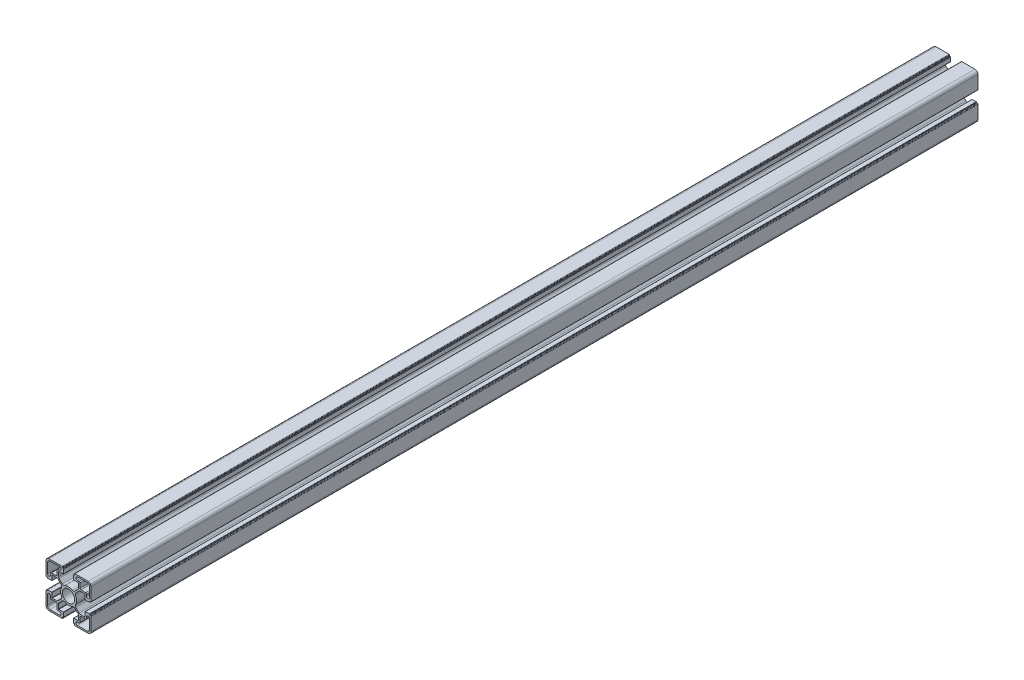
from build123d import *

# Parameters (mm, degrees)
BOSS_EXTRUDE4_DEPTH = 885.824088964
SCALE1_SCALE        = 0.5644444


with BuildPart() as part:
    # Sketch1 → Boss-Extrude4 (new body)
    with BuildSketch(Plane.XY):
        with BuildLine():
            Line((-22.5, 19.5), (-22.5, 6.3))
            ThreePointArc((-22.5, 6.3), (-22.353553391, 5.946446609), (-22, 5.8))
            Line((-22, 5.8), (-21.3, 5.8))
            ThreePointArc((-21.3, 5.8), (-21.087867966, 5.712132034), (-21, 5.5))
            Line((-21, 5.5), (-21, 5.3))
            ThreePointArc((-21, 5.3), (-20.912132034, 5.087867966), (-20.7, 5))
            Line((-20.7, 5), (-16.7, 5))
            ThreePointArc((-16.7, 5), (-16.558578644, 5.058578644), (-16.5, 5.2))
            Line((-16.5, 5.2), (-16.5, 9.8))
            ThreePointArc((-16.5, 9.8), (-16.441421356, 9.941421356), (-16.3, 10))
            Line((-16.3, 10), (-11.864234483, 10))
            ThreePointArc((-11.864234483, 10), (-11.121828624, 9.852326293), (-10.492447327, 9.431787156))
            Line((-10.492447327, 9.431787156), (-7.296699127, 6.236038955))
            ThreePointArc((-7.296699127, 6.236038955), (-6.746669172, 5.129240469), (-6.976648919, 3.914890784))
            ThreePointArc((-6.976648919, 3.914890784), (-7.739935121, 2.023216331), (-8, 0))
            ThreePointArc((-8, 0), (-7.739935121, -2.023216331), (-6.976648919, -3.914890784))
            ThreePointArc((-6.976648919, -3.914890784), (-6.746669172, -5.129240469), (-7.296699127, -6.236038955))
            Line((-7.296699127, -6.236038955), (-10.492447327, -9.431787156))
            ThreePointArc((-10.492447327, -9.431787156), (-11.121828624, -9.852326293), (-11.864234483, -10))
            Line((-11.864234483, -10), (-16.3, -10))
            ThreePointArc((-16.3, -10), (-16.441421356, -9.941421356), (-16.5, -9.8))
            Line((-16.5, -9.8), (-16.5, -5.2))
            ThreePointArc((-16.5, -5.2), (-16.558578644, -5.058578644), (-16.7, -5))
            Line((-16.7, -5), (-20.7, -5))
            ThreePointArc((-20.7, -5), (-20.912132034, -5.087867966), (-21, -5.3))
            Line((-21, -5.3), (-21, -5.5))
            ThreePointArc((-21, -5.5), (-21.087867966, -5.712132034), (-21.3, -5.8))
            Line((-21.3, -5.8), (-22, -5.8))
            ThreePointArc((-22, -5.8), (-22.353553391, -5.946446609), (-22.5, -6.3))
            Line((-22.5, -6.3), (-22.5, -19.5))
            ThreePointArc((-22.5, -19.5), (-21.621320344, -21.621320344), (-19.5, -22.5))
            Line((-19.5, -22.5), (-6.3, -22.5))
            ThreePointArc((-6.3, -22.5), (-5.946446609, -22.353553391), (-5.8, -22))
            Line((-5.8, -22), (-5.8, -21.3))
            ThreePointArc((-5.8, -21.3), (-5.712132034, -21.087867966), (-5.5, -21))
            Line((-5.5, -21), (-5.3, -21))
            ThreePointArc((-5.3, -21), (-5.087867966, -20.912132034), (-5, -20.7))
            Line((-5, -20.7), (-5, -16.7))
            ThreePointArc((-5, -16.7), (-5.058578644, -16.558578644), (-5.2, -16.5))
            Line((-5.2, -16.5), (-9.8, -16.5))
            ThreePointArc((-9.8, -16.5), (-9.941421356, -16.441421356), (-10, -16.3))
            Line((-10, -16.3), (-10, -11.864234483))
            ThreePointArc((-10, -11.864234483), (-9.852326293, -11.121828624), (-9.431787156, -10.492447327))
            Line((-9.431787156, -10.492447327), (-6.236038955, -7.296699127))
            ThreePointArc((-6.236038955, -7.296699127), (-5.129240469, -6.746669172), (-3.914890784, -6.976648919))
            ThreePointArc((-3.914890784, -6.976648919), (-2.023216331, -7.739935121), (0, -8))
            ThreePointArc((0, -8), (2.023216331, -7.739935121), (3.914890784, -6.976648919))
            ThreePointArc((3.914890784, -6.976648919), (5.129240469, -6.746669172), (6.236038955, -7.296699127))
            Line((6.236038955, -7.296699127), (9.431787156, -10.492447327))
            ThreePointArc((9.431787156, -10.492447327), (9.852326293, -11.121828624), (10, -11.864234483))
            Line((10, -11.864234483), (10, -16.3))
            ThreePointArc((10, -16.3), (9.941421356, -16.441421356), (9.8, -16.5))
            Line((9.8, -16.5), (5.2, -16.5))
            ThreePointArc((5.2, -16.5), (5.058578644, -16.558578644), (5, -16.7))
            Line((5, -16.7), (5, -20.7))
            ThreePointArc((5, -20.7), (5.087867966, -20.912132034), (5.3, -21))
            Line((5.3, -21), (5.5, -21))
            ThreePointArc((5.5, -21), (5.712132034, -21.087867966), (5.8, -21.3))
            Line((5.8, -21.3), (5.8, -22))
            ThreePointArc((5.8, -22), (5.946446609, -22.353553391), (6.3, -22.5))
            Line((6.3, -22.5), (19.5, -22.5))
            ThreePointArc((19.5, -22.5), (21.621320344, -21.621320344), (22.5, -19.5))
            Line((22.5, -19.5), (22.5, -6.3))
            ThreePointArc((22.5, -6.3), (22.353553391, -5.946446609), (22, -5.8))
            Line((22, -5.8), (21.3, -5.8))
            ThreePointArc((21.3, -5.8), (21.087867966, -5.712132034), (21, -5.5))
            Line((21, -5.5), (21, -5.3))
            ThreePointArc((21, -5.3), (20.912132034, -5.087867966), (20.7, -5))
            Line((20.7, -5), (16.7, -5))
            ThreePointArc((16.7, -5), (16.558578644, -5.058578644), (16.5, -5.2))
            Line((16.5, -5.2), (16.5, -9.8))
            ThreePointArc((16.5, -9.8), (16.441421356, -9.941421356), (16.3, -10))
            Line((16.3, -10), (11.864234483, -10))
            ThreePointArc((11.864234483, -10), (11.121828624, -9.852326293), (10.492447327, -9.431787156))
            Line((10.492447327, -9.431787156), (7.296699127, -6.236038955))
            ThreePointArc((7.296699127, -6.236038955), (6.746669172, -5.129240469), (6.976648919, -3.914890784))
            ThreePointArc((6.976648919, -3.914890784), (7.739935121, -2.023216331), (8, 0))
            ThreePointArc((8, 0), (7.739935121, 2.023216331), (6.976648919, 3.914890784))
            ThreePointArc((6.976648919, 3.914890784), (6.746669172, 5.129240469), (7.296699127, 6.236038955))
            Line((7.296699127, 6.236038955), (10.492447327, 9.431787156))
            ThreePointArc((10.492447327, 9.431787156), (11.121828624, 9.852326293), (11.864234483, 10))
            Line((11.864234483, 10), (16.3, 10))
            ThreePointArc((16.3, 10), (16.441421356, 9.941421356), (16.5, 9.8))
            Line((16.5, 9.8), (16.5, 5.2))
            ThreePointArc((16.5, 5.2), (16.558578644, 5.058578644), (16.7, 5))
            Line((16.7, 5), (20.7, 5))
            ThreePointArc((20.7, 5), (20.912132034, 5.087867966), (21, 5.3))
            Line((21, 5.3), (21, 5.5))
            ThreePointArc((21, 5.5), (21.087867966, 5.712132034), (21.3, 5.8))
            Line((21.3, 5.8), (22, 5.8))
            ThreePointArc((22, 5.8), (22.353553391, 5.946446609), (22.5, 6.3))
            Line((22.5, 6.3), (22.5, 19.5))
            ThreePointArc((22.5, 19.5), (21.621320344, 21.621320344), (19.5, 22.5))
            Line((19.5, 22.5), (6.3, 22.5))
            ThreePointArc((6.3, 22.5), (5.946446609, 22.353553391), (5.8, 22))
            Line((5.8, 22), (5.8, 21.3))
            ThreePointArc((5.8, 21.3), (5.712132034, 21.087867966), (5.5, 21))
            Line((5.5, 21), (5.3, 21))
            ThreePointArc((5.3, 21), (5.087867966, 20.912132034), (5, 20.7))
            Line((5, 20.7), (5, 16.7))
            ThreePointArc((5, 16.7), (5.058578644, 16.558578644), (5.2, 16.5))
            Line((5.2, 16.5), (9.8, 16.5))
            ThreePointArc((9.8, 16.5), (9.941421356, 16.441421356), (10, 16.3))
            Line((10, 16.3), (10, 11.864234483))
            ThreePointArc((10, 11.864234483), (9.852326293, 11.121828624), (9.431787156, 10.492447327))
            Line((9.431787156, 10.492447327), (6.236038955, 7.296699127))
            ThreePointArc((6.236038955, 7.296699127), (5.129240469, 6.746669172), (3.914890784, 6.976648919))
            ThreePointArc((3.914890784, 6.976648919), (2.023216331, 7.739935121), (0, 8))
            ThreePointArc((0, 8), (-2.023216331, 7.739935121), (-3.914890784, 6.976648919))
            ThreePointArc((-3.914890784, 6.976648919), (-5.129240469, 6.746669172), (-6.236038955, 7.296699127))
            Line((-6.236038955, 7.296699127), (-9.431787156, 10.492447327))
            ThreePointArc((-9.431787156, 10.492447327), (-9.852326293, 11.121828624), (-10, 11.864234483))
            Line((-10, 11.864234483), (-10, 16.3))
            ThreePointArc((-10, 16.3), (-9.941421356, 16.441421356), (-9.8, 16.5))
            Line((-9.8, 16.5), (-5.2, 16.5))
            ThreePointArc((-5.2, 16.5), (-5.058578644, 16.558578644), (-5, 16.7))
            Line((-5, 16.7), (-5, 20.7))
            ThreePointArc((-5, 20.7), (-5.087867966, 20.912132034), (-5.3, 21))
            Line((-5.3, 21), (-5.5, 21))
            ThreePointArc((-5.5, 21), (-5.712132034, 21.087867966), (-5.8, 21.3))
            Line((-5.8, 21.3), (-5.8, 22))
            ThreePointArc((-5.8, 22), (-5.946446609, 22.353553391), (-6.3, 22.5))
            Line((-6.3, 22.5), (-19.5, 22.5))
            ThreePointArc((-19.5, 22.5), (-21.621320344, 21.621320344), (-22.5, 19.5))
        make_face()
        with BuildLine():
            Line((-21, 18.5), (-21, 9))
            ThreePointArc((-21, 9), (-19.5, 7.5), (-18, 9))
            Line((-18, 9), (-18, 10.5))
            ThreePointArc((-18, 10.5), (-17.707106781, 11.207106781), (-17, 11.5))
            Line((-17, 11.5), (-12.5, 11.5))
            ThreePointArc((-12.5, 11.5), (-11.792893219, 11.792893219), (-11.5, 12.5))
            Line((-11.5, 12.5), (-11.5, 17))
            ThreePointArc((-11.5, 17), (-11.207106781, 17.707106781), (-10.5, 18))
            Line((-10.5, 18), (-9, 18))
            ThreePointArc((-9, 18), (-7.5, 19.5), (-9, 21))
            Line((-9, 21), (-18.5, 21))
            ThreePointArc((-18.5, 21), (-20.267766953, 20.267766953), (-21, 18.5))
        make_face(mode=Mode.SUBTRACT)
        with BuildLine():
            Line((18.5, 21), (9, 21))
            ThreePointArc((9, 21), (7.5, 19.5), (9, 18))
            Line((9, 18), (10.5, 18))
            ThreePointArc((10.5, 18), (11.207106781, 17.707106781), (11.5, 17))
            Line((11.5, 17), (11.5, 12.5))
            ThreePointArc((11.5, 12.5), (11.792893219, 11.792893219), (12.5, 11.5))
            Line((12.5, 11.5), (17, 11.5))
            ThreePointArc((17, 11.5), (17.707106781, 11.207106781), (18, 10.5))
            Line((18, 10.5), (18, 9))
            ThreePointArc((18, 9), (19.5, 7.5), (21, 9))
            Line((21, 9), (21, 18.5))
            ThreePointArc((21, 18.5), (20.267766953, 20.267766953), (18.5, 21))
        make_face(mode=Mode.SUBTRACT)
        with BuildLine():
            Line((21, -18.5), (21, -9))
            ThreePointArc((21, -9), (19.5, -7.5), (18, -9))
            Line((18, -9), (18, -10.5))
            ThreePointArc((18, -10.5), (17.707106781, -11.207106781), (17, -11.5))
            Line((17, -11.5), (12.5, -11.5))
            ThreePointArc((12.5, -11.5), (11.792893219, -11.792893219), (11.5, -12.5))
            Line((11.5, -12.5), (11.5, -17))
            ThreePointArc((11.5, -17), (11.207106781, -17.707106781), (10.5, -18))
            Line((10.5, -18), (9, -18))
            ThreePointArc((9, -18), (7.5, -19.5), (9, -21))
            Line((9, -21), (18.5, -21))
            ThreePointArc((18.5, -21), (20.267766953, -20.267766953), (21, -18.5))
        make_face(mode=Mode.SUBTRACT)
        with BuildLine():
            Line((-18.5, -21), (-9, -21))
            ThreePointArc((-9, -21), (-7.5, -19.5), (-9, -18))
            Line((-9, -18), (-10.5, -18))
            ThreePointArc((-10.5, -18), (-11.207106781, -17.707106781), (-11.5, -17))
            Line((-11.5, -17), (-11.5, -12.5))
            ThreePointArc((-11.5, -12.5), (-11.792893219, -11.792893219), (-12.5, -11.5))
            Line((-12.5, -11.5), (-17, -11.5))
            ThreePointArc((-17, -11.5), (-17.707106781, -11.207106781), (-18, -10.5))
            Line((-18, -10.5), (-18, -9))
            ThreePointArc((-18, -9), (-19.5, -7.5), (-21, -9))
            Line((-21, -9), (-21, -18.5))
            ThreePointArc((-21, -18.5), (-20.267766953, -20.267766953), (-18.5, -21))
        make_face(mode=Mode.SUBTRACT)
        with BuildLine():
            ThreePointArc((0, 6.1), (-4.313351365, 4.313351365), (-6.1, 0))
            ThreePointArc((-6.1, 0), (-4.313351365, -4.313351365), (0, -6.1))
            ThreePointArc((0, -6.1), (4.313351365, -4.313351365), (6.1, 0))
            ThreePointArc((6.1, 0), (4.313351365, 4.313351365), (0, 6.1))
        make_face(mode=Mode.SUBTRACT)
    extrude(amount=BOSS_EXTRUDE4_DEPTH)


with BuildPart() as part_1:
    # Scale1: scaled about (0, 0, 442.912044482)
    add(part.part.scale(SCALE1_SCALE).moved(Location((0, 0, 192.912821282))))


solid = part_1.part
